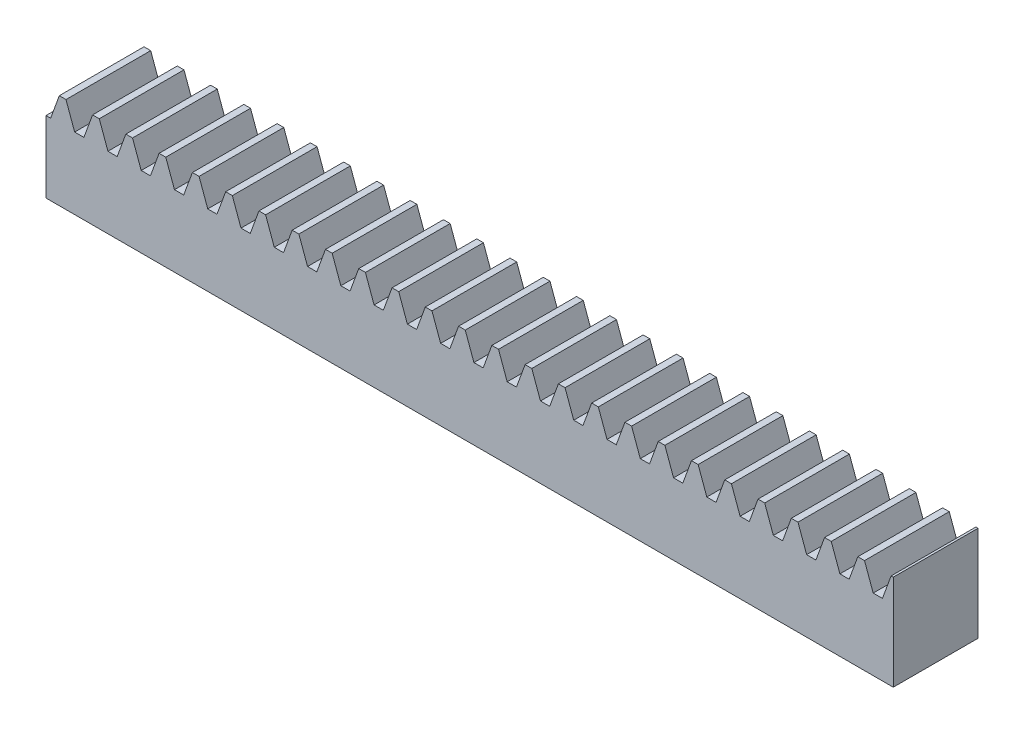
from build123d import *

# Parameters (mm, degrees)
BLANKSKE_W        = 120
BLANKSKE_H        = 13.5
BLANK_DEPTH       = 12
TOOTHCUTSIM_DEPTH = 122.351761421
TEETHCUTS_COUNT   = 26
TEETHCUTS_PITCH   = 4.712388975


with BuildPart() as part:
    # BlankSke → Blank (new body)
    with BuildSketch(Plane.XY):
        with Locations((60, 6.75)):
            Rectangle(BLANKSKE_W, BLANKSKE_H)
    extrude(amount=-BLANK_DEPTH)

    # TooCutSkeSim → ToothCutSim (cut, through all)
    with BuildSketch(Plane.XY):
        Polygon((0.654653055, 10.125), (-0.654653055, 10.125), (-1.892297439, 13.5254), (1.892297439, 13.5254), align=None)
    toothcutsim = extrude(amount=-TOOTHCUTSIM_DEPTH, mode=Mode.SUBTRACT)

    # TeethCuts: ToothCutSim ×26
    with Locations(*[(i * TEETHCUTS_PITCH, 0, 0) for i in range(1, TEETHCUTS_COUNT)]):
        add(toothcutsim, mode=Mode.SUBTRACT)


solid = part.part
